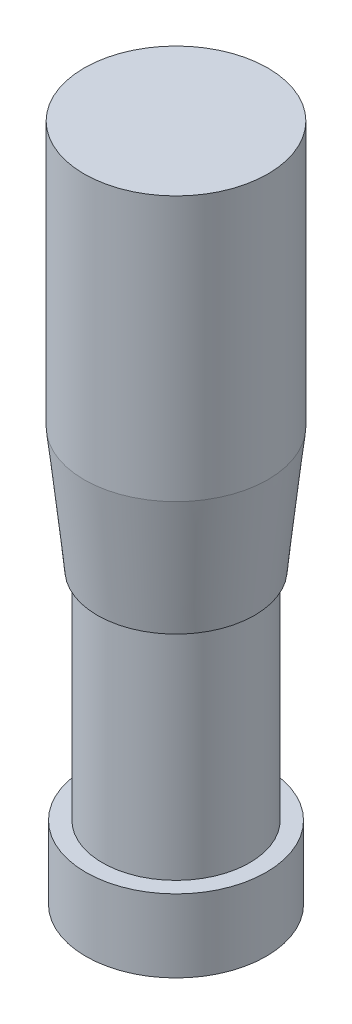
from build123d import *


with BuildPart() as part:
    # Sketch1 → Revolve1 (revolve)
    with BuildSketch(Plane.XY, mode=Mode.PRIVATE) as revolve1_sk:
        Polygon((0, 0), (-5.45, 0), (-5.45, 4.4), (-4.45, 4.4), (-4.45, 17.5), (-4.75, 17.5), (-5.55, 25), (-5.55, 41), (0, 41), align=None)
    revolve(revolve1_sk.sketch.rotate(Axis((0, 0, 0), (0, 1, 0)), 270), axis=Axis((0, 0, 0), (0, 1, 0)))


solid = part.part
